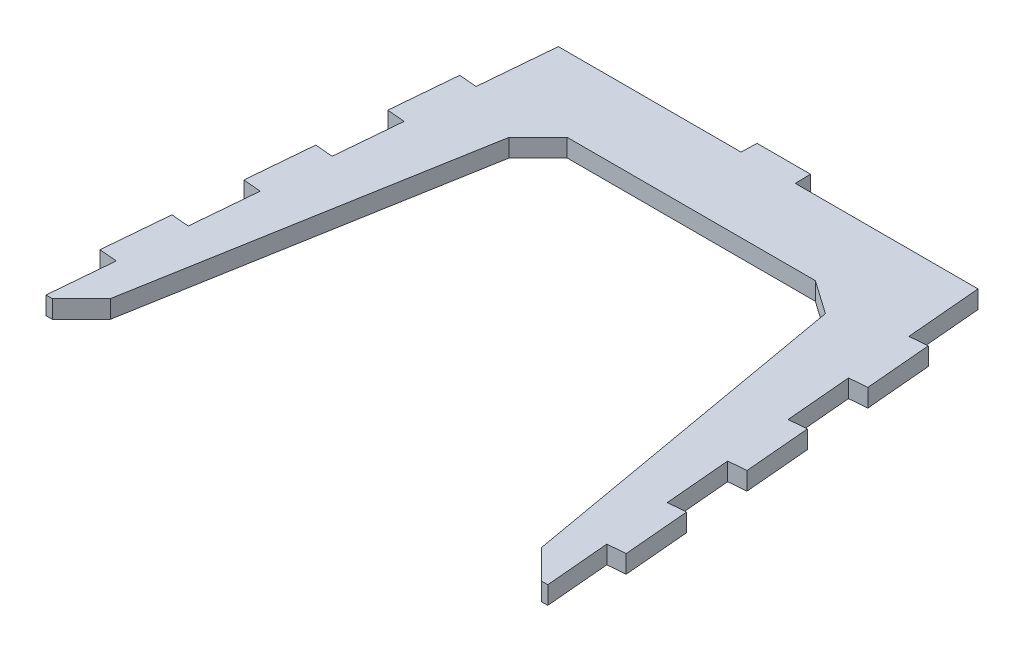
from build123d import *
from OCP.BRepFilletAPI import BRepFilletAPI_MakeChamfer

# Parameters (mm, degrees)
BOSS_EXTRUDE1_DEPTH = 15
CHAMFER1_SIZE       = 20
CHAMFER1_SIZE2      = 24.644345169
CHAMFER2_SIZE       = 20
CHAMFER2_SIZE2      = 24.644345169
CUT_EXTRUDE1_DEPTH  = 455.278391079
BOSS_EXTRUDE2_DEPTH = 15


with BuildPart() as part:
    # Sketch2 → Boss-Extrude1 (new body)
    with BuildSketch(Plane(origin=(0, 0, 0), x_dir=(1, 0, 0), z_dir=(0, 1, 0))):
        Polygon((-190.630365757, 0), (-225, -394.358791714), (-184.655281407, -394.358791714), (-126.173678801, -62.046246538), (126.173678801, -62.046246538), (184.655281407, -394.358791714), (225, -394.358791714), (190.630365757, 0), align=None)
    extrude(amount=-BOSS_EXTRUDE1_DEPTH)

    # Chamfer1: one chamfer whose edges measure the first distance from different faces: ONE call of the kernel's chamfer builder (chamfer() names one face for all edges)
    chamfer1_edges_1 = [part.edges().sort_by_distance(p)[0] for p in [
        (184.655281407, -7.5, 394.358791714),
    ]]
    chamfer1_side_1 = [part.faces().sort_by_distance(p)[0] for p in [
        (204.827640703, -7.5, 394.358791714),
    ]]
    chamfer1_edges_2 = [part.edges().sort_by_distance(p)[0] for p in [
        (-184.655281407, -7.5, 394.358791714),
    ]]
    chamfer1_side_2 = [part.faces().sort_by_distance(p)[0] for p in [
        (-204.827640703, -7.5, 394.358791714),
    ]]
    chamfer1 = BRepFilletAPI_MakeChamfer(part.part.solid().wrapped)
    for e in chamfer1_edges_1:
        chamfer1.Add(CHAMFER1_SIZE, CHAMFER1_SIZE2, e.wrapped, chamfer1_side_1[0].wrapped)  # the first distance lies on this face
    for e in chamfer1_edges_2:
        chamfer1.Add(CHAMFER1_SIZE, CHAMFER1_SIZE2, e.wrapped, chamfer1_side_2[0].wrapped)  # the first distance lies on this face
    add(Compound.cast(chamfer1.Shape()), mode=Mode.REPLACE)

    # Chamfer2: one chamfer whose edges measure the first distance from different faces: ONE call of the kernel's chamfer builder (chamfer() names one face for all edges)
    chamfer2_edges_1 = [part.edges().sort_by_distance(p)[0] for p in [
        (126.173678801, -7.5, 62.046246538),
    ]]
    chamfer2_side_1 = [part.faces().sort_by_distance(p)[0] for p in [
        (153.278797334, -7.5, 216.066836355),
    ]]
    chamfer2_edges_2 = [part.edges().sort_by_distance(p)[0] for p in [
        (-126.173678801, -7.5, 62.046246538),
    ]]
    chamfer2_side_2 = [part.faces().sort_by_distance(p)[0] for p in [
        (0, -7.5, 62.046246538),
    ]]
    chamfer2 = BRepFilletAPI_MakeChamfer(part.part.solid().wrapped)
    for e in chamfer2_edges_1:
        chamfer2.Add(CHAMFER2_SIZE, CHAMFER2_SIZE2, e.wrapped, chamfer2_side_1[0].wrapped)  # the first distance lies on this face
    for e in chamfer2_edges_2:
        chamfer2.Add(CHAMFER2_SIZE, CHAMFER2_SIZE2, e.wrapped, chamfer2_side_2[0].wrapped)  # the first distance lies on this face
    add(Compound.cast(chamfer2.Shape()), mode=Mode.REPLACE)

    # Sketch3 → Cut-Extrude1 (cut, through all)
    with BuildSketch(Plane(origin=(0, 0, 0), x_dir=(1, 0, 0), z_dir=(0, 1, 0))):
        Polygon((-196.037895257, -62.046246538), (-181.094105963, -63.348645731), (-175.573068194, 0), (-190.630365757, 0), align=None)
        Polygon((-210.518947628, -228.202519126), (-195.575158335, -229.504918319), (-200.402175792, -284.890342515), (-215.345965086, -283.587943322), align=None)
        Polygon((-220.172982543, -338.973367518), (-225, -394.358791714), (-209.942702437, -394.358791714), (-205.229193249, -340.275766711), align=None)
        Polygon((-200.864912714, -117.431670734), (-205.691930171, -172.81709493), (-190.748140877, -174.119494123), (-185.92112342, -118.734069927), align=None)
    cut_extrude1 = extrude(amount=-CUT_EXTRUDE1_DEPTH, mode=Mode.SUBTRACT)

    # Mirror1: Cut-Extrude1 across plane
    add(cut_extrude1.mirror(Plane(origin=(0, 0, 0), x_dir=(0, 0, 1), z_dir=(1, 0, 0))), mode=Mode.SUBTRACT)

    # Sketch5 → Boss-Extrude2 (add)
    with BuildSketch(Plane(origin=(0, 0, 0), x_dir=(1, 0, 0), z_dir=(0, 1, 0))):
        Polygon((-22.687908556, 0), (22.687908556, 0), (22.346610744, 13.033637599), (-22.346610744, 13.033637599), align=None)
    extrude(amount=-BOSS_EXTRUDE2_DEPTH)


solid = part.part
